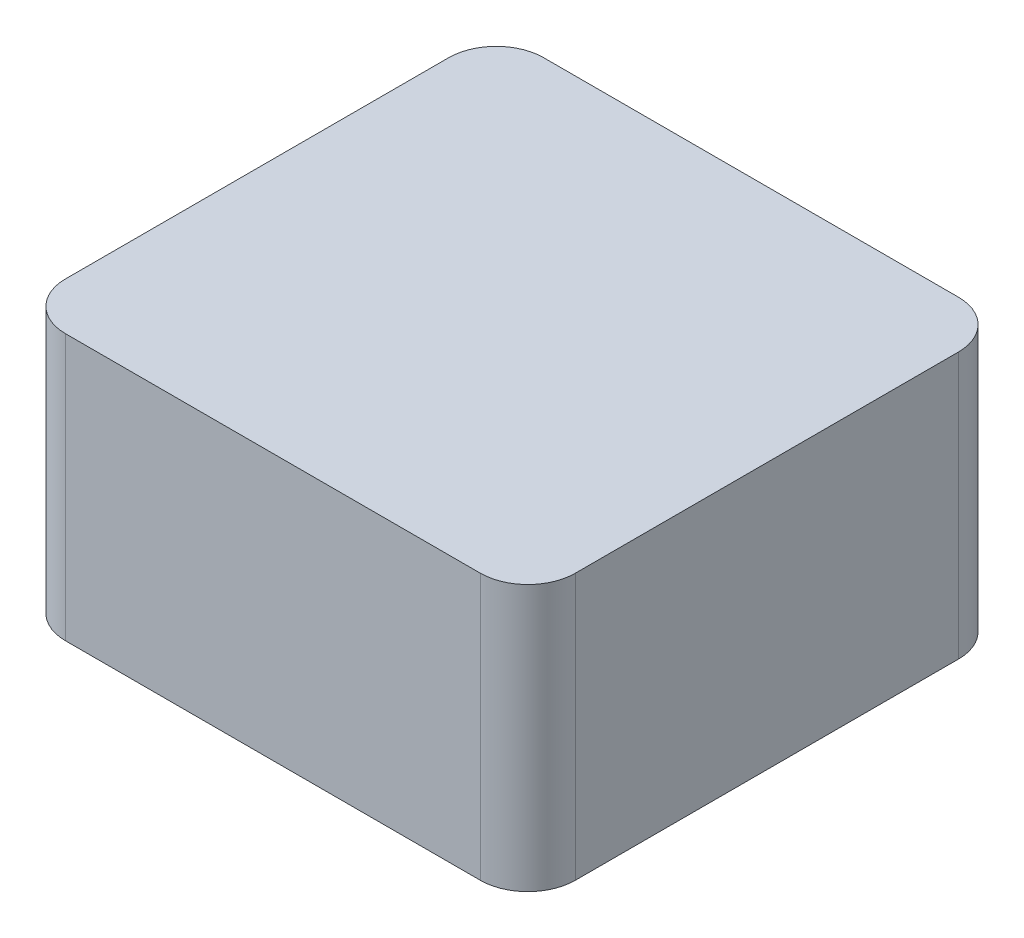
from build123d import *

# Parameters (mm, degrees)
SKETCH1_W           = 40.894
SKETCH1_H           = 38.354
BOSS_EXTRUDE1_DEPTH = 21.336
FILLET1_R           = 3.81


with BuildPart() as part:
    # Sketch1 → Boss-Extrude1 (new body)
    with BuildSketch(Plane(origin=(0, 0, 0), x_dir=(1, 0, 0), z_dir=(0, 1, 0))):
        with Locations((20.447, -19.177)):
            Rectangle(SKETCH1_W, SKETCH1_H)
    extrude(amount=BOSS_EXTRUDE1_DEPTH)

    # Fillet1
    fillet1_edges = [part.edges().sort_by_distance(p)[0] for p in [
        (0, 10.668, 0),
        (40.894, 10.668, 0),
        (40.894, 10.668, 38.354),
        (0, 10.668, 38.354),
    ]]
    fillet(fillet1_edges, radius=FILLET1_R)


solid = part.part
